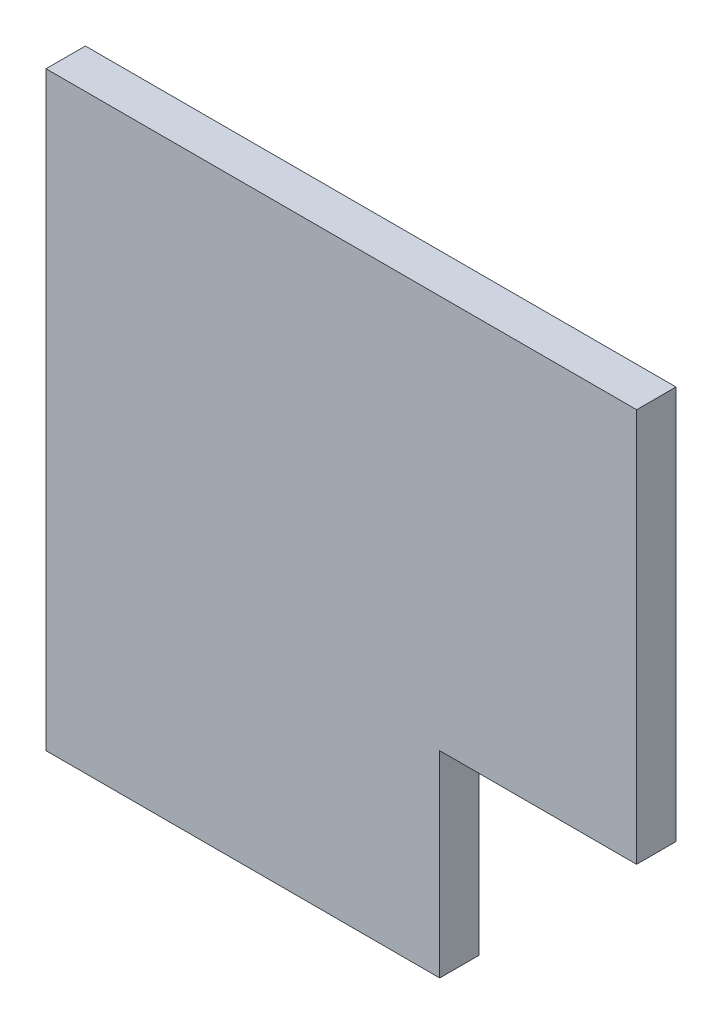
from build123d import *

# Parameters (mm, degrees)
BOSS_EXTRUDE1_DEPTH = 0.05


with BuildPart() as part:
    # Sketch1 → Boss-Extrude1 (new, symmetric)
    with BuildSketch(Plane.XY):
        Polygon((0, 0), (0, 1), (-1.5, 1), (-1.5, -0.5), (-0.5, -0.5), (-0.5, 0), align=None)
    extrude(amount=BOSS_EXTRUDE1_DEPTH, both=True)


solid = part.part
